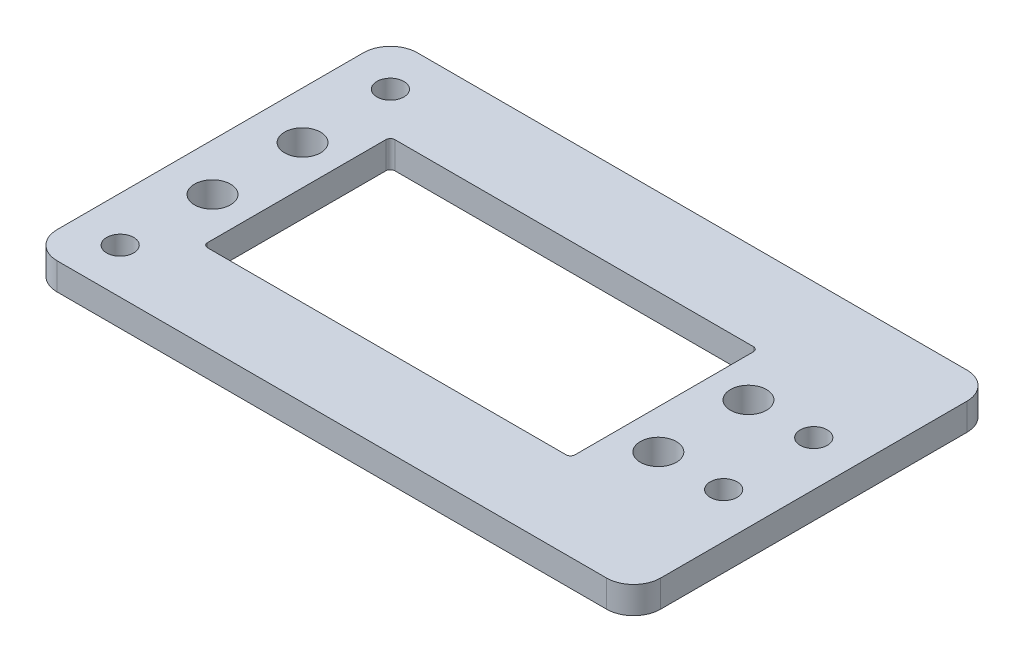
from build123d import *

# Parameters (mm, degrees)
SKETCH_1_W      = 60
SKETCH_1_H      = 40
SKETCH_1_R      = 2
SKETCH_1_R_2    = 1.5
SKETCH_1_W_2    = 40.8
SKETCH_1_H_2    = 20.8
SKETCH_1_W_3    = 7
EXTRUDE_1_DEPTH = 3
FILLET_1_R      = 0.5
FILLET_2_R      = 3


with BuildPart() as part:
    # 草图1 → 凸台-拉伸1 (new body)
    # profile 1 of 2: a face of its own
    with BuildSketch(Plane(origin=(0, 0, 0), x_dir=(1, 0, 0), z_dir=(0, 1, 0))):
        Rectangle(SKETCH_1_W, SKETCH_1_H)
        with Locations(Location((-24.75, 5, 0), (0, 0, 270))):
            Circle(SKETCH_1_R, mode=Mode.SUBTRACT)
        with Locations(Location((-24.75, -5, 0), (0, 0, 270))):
            Circle(SKETCH_1_R, mode=Mode.SUBTRACT)
        with Locations(Location((24.75, 5, 0), (0, 0, 270))):
            Circle(SKETCH_1_R, mode=Mode.SUBTRACT)
        with Locations(Location((24.75, -5, 0), (0, 0, 270))):
            Circle(SKETCH_1_R, mode=Mode.SUBTRACT)
        with Locations(Location((-25, 15, 0), (0, 0, 270))):
            Circle(SKETCH_1_R_2, mode=Mode.SUBTRACT)
        with Locations(Location((-25, -15, 0), (0, 0, 270))):
            Circle(SKETCH_1_R_2, mode=Mode.SUBTRACT)
        Rectangle(SKETCH_1_W_2, SKETCH_1_H_2, mode=Mode.SUBTRACT)
    # profile 2 of 2: a face of its own
    with BuildSketch(Plane(origin=(0, 0, 0), x_dir=(1, 0, 0), z_dir=(0, 1, 0))):
        with Locations((33.5, 0)):
            Rectangle(SKETCH_1_W_3, SKETCH_1_H)
        with Locations(Location((32, 5, 0), (0, 0, 270))):
            Circle(SKETCH_1_R_2, mode=Mode.SUBTRACT)
        with Locations(Location((32, -5, 0), (0, 0, 270))):
            Circle(SKETCH_1_R_2, mode=Mode.SUBTRACT)
    extrude(amount=EXTRUDE_1_DEPTH)

    # 圆角1
    fillet_1_edges = [part.edges().sort_by_distance(p)[0] for p in [
        (20.4, 1.5, -10.4),
        (-20.4, 1.5, -10.4),
        (-20.4, 1.5, 10.4),
        (20.4, 1.5, 10.4),
    ]]
    fillet(fillet_1_edges, radius=FILLET_1_R)

    # 圆角2
    fillet_2_edges = [part.edges().sort_by_distance(p)[0] for p in [
        (-30, 1.5, 20),
        (-30, 1.5, -20),
        (37, 1.5, -20),
        (37, 1.5, 20),
    ]]
    fillet(fillet_2_edges, radius=FILLET_2_R)


solid = part.part
